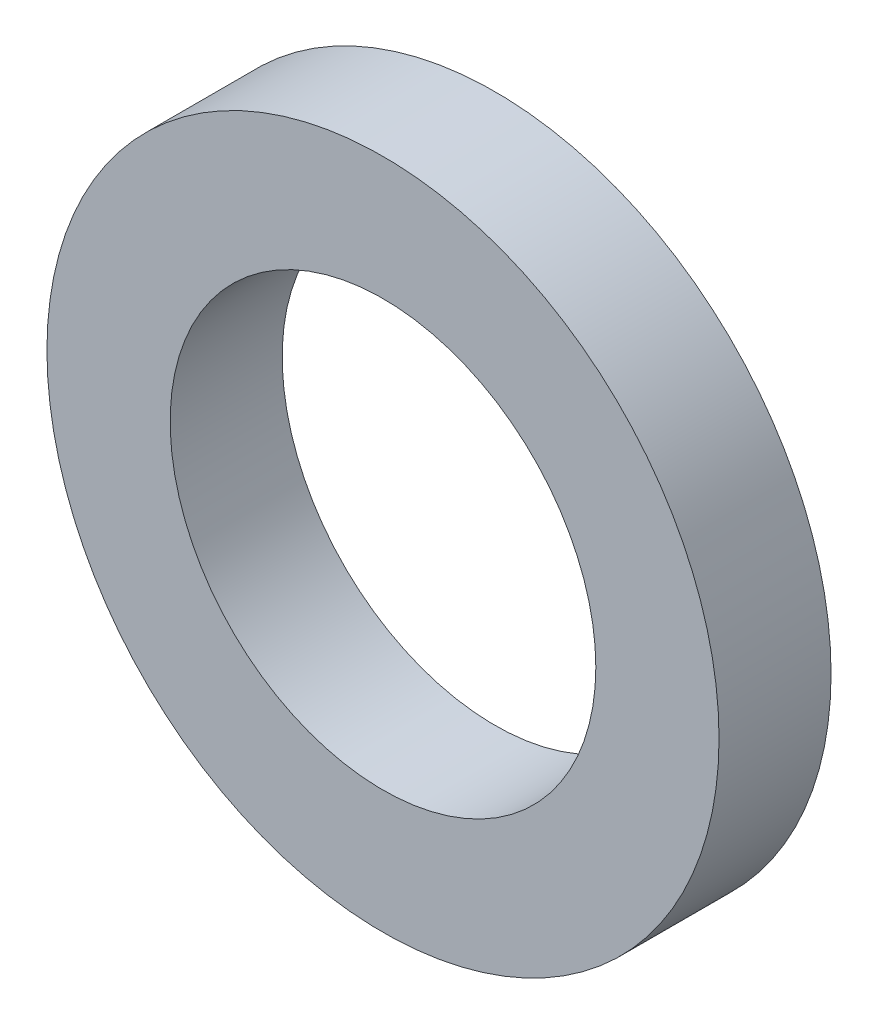
from build123d import *

# Parameters (mm, degrees)
SKETCH1_R           = 3
SKETCH1_R_2         = 1.9
BOSS_EXTRUDE1_DEPTH = 1


with BuildPart() as part:
    # Sketch1 → Boss-Extrude1 (new body)
    with BuildSketch(Plane.XY):
        Circle(SKETCH1_R)
        Circle(SKETCH1_R_2, mode=Mode.SUBTRACT)
    extrude(amount=BOSS_EXTRUDE1_DEPTH)


solid = part.part
